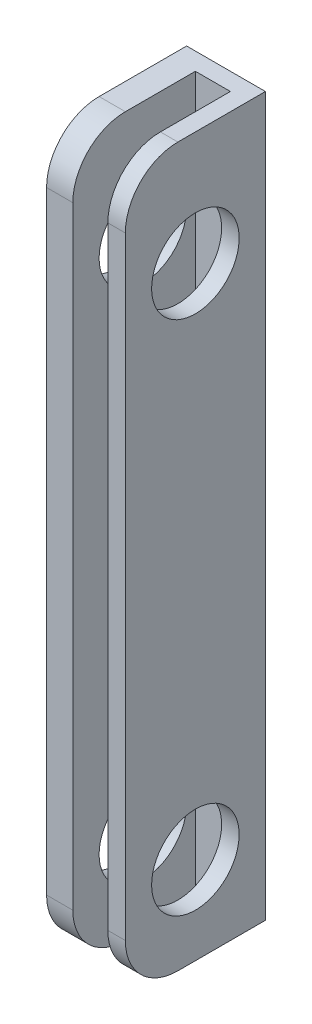
from build123d import *

# Parameters (mm, degrees)
SKETCH_1_W          = 4.5
SKETCH_1_H          = 41
EXTRUDE_1_DEPTH     = 8
SKETCH_3_W          = 2
SKETCH_3_H          = 41
CUT_EXTRUDE_1_DEPTH = 7
SKETCH_5_R          = 2.5
CUT_EXTRUDE_2_DEPTH = 23.461077445
FILLET_1_R          = 3


with BuildPart() as part:
    # Эскиз1 → Бобышка-Вытянуть1 (new body)
    with BuildSketch(Plane.XY):
        Rectangle(SKETCH_1_W, SKETCH_1_H)
    extrude(amount=EXTRUDE_1_DEPTH)

    # Эскиз3 → Вырез-Вытянуть1 (cut)
    with BuildSketch(Plane.XY.offset(8)):
        with Locations((0.25, 0)):
            Rectangle(SKETCH_3_W, SKETCH_3_H)
    extrude(amount=-CUT_EXTRUDE_1_DEPTH, mode=Mode.SUBTRACT)

    # Эскиз5 → Вырез-Вытянуть2 (cut, through all)
    with BuildSketch(Plane(origin=(2.25, 0, 0), x_dir=(0, 0, -1), z_dir=(1, 0, 0))):
        with Locations(Location((-4, 14, 0), (0, 0, 90))):
            Circle(SKETCH_5_R)
        with Locations(Location((-4, -15.5, 0), (0, 0, 90))):
            Circle(SKETCH_5_R)
    extrude(amount=-CUT_EXTRUDE_2_DEPTH, mode=Mode.SUBTRACT)

    # Скругление1
    fillet_1_edges = [part.edges().sort_by_distance(p)[0] for p in [
        (-1.5, 20.5, 8),
        (1.75, -20.5, 8),
        (-1.5, -20.5, 8),
        (1.75, 20.5, 8),
    ]]
    fillet(fillet_1_edges, radius=FILLET_1_R)


solid = part.part
